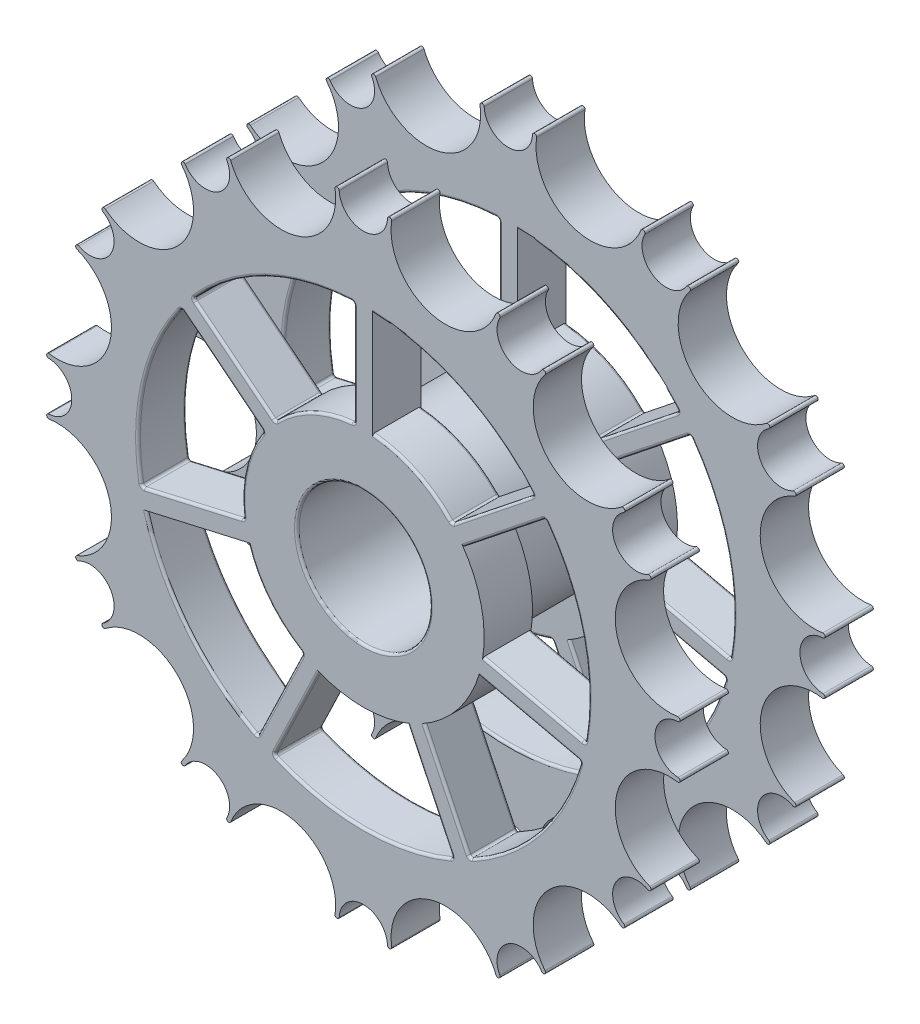
from build123d import *

# Parameters (mm, degrees)
BOSS_EXTRUDE1_DEPTH = 20
CUT_EXTRUDE1_REACH  = 330.167
SKETCH3_R           = 93.291525657
SKETCH4_R           = 50
BOSS_EXTRUDE2_DEPTH = 20
SKETCH7_W           = 7.655109398
SKETCH7_H           = 49.788152553
BOSS_EXTRUDE3_DEPTH = 20
CIRPATTERN1_COUNT   = 7
SKETCH8_R           = 27.538934532
CUT_EXTRUDE2_DEPTH  = 20
BOSS_EXTRUDE4_START = 39.999999756
SKETCH9_R           = 37.538934532
SKETCH9_R_2         = 27.538934532
BOSS_EXTRUDE4_DEPTH = 39.999999756
FILLET2_R           = 1


with BuildPart() as part:
    # Sketch2 → Boss-Extrude1 (new body)
    with BuildSketch(Plane.XY):
        with BuildLine():
            ThreePointArc((-179.091353862, 130.254695857), (-176.022517633, 123.453884992), (-169.1, 120.67044578))
            ThreePointArc((-169.1, 120.67044578), (-162.177482367, 123.453884992), (-159.108646138, 130.254695857))
            ThreePointArc((-159.108646138, 130.254695857), (-158.161758626, 131.08003725), (-157.388508681, 130.090153975))
            ThreePointArc((-157.388508681, 130.090153975), (-140.961721844, 105.013483715), (-114.197372011, 118.517123784))
            ThreePointArc((-114.197372011, 118.517123784), (-113.032776278, 118.987762875), (-112.625418334, 117.799552506))
            ThreePointArc((-112.625418334, 117.799552506), (-113.368133633, 110.375459415), (-108.76477711, 104.503671532))
            ThreePointArc((-108.76477711, 104.503671532), (-101.377981375, 103.452941782), (-95.319885808, 107.808198643))
            ThreePointArc((-95.319885808, 107.808198643), (-94.087186472, 108.0495215), (-93.912474015, 106.805632465))
            ThreePointArc((-93.912474015, 106.805632465), (-92.224794441, 76.875205559), (-62.294367535, 75.187525985))
            ThreePointArc((-62.294367535, 75.187525985), (-61.0504785, 75.012813528), (-61.291801357, 73.780114192))
            ThreePointArc((-61.291801357, 73.780114192), (-65.647058218, 67.722018625), (-64.596328468, 60.33522289))
            ThreePointArc((-64.596328468, 60.33522289), (-58.724540585, 55.731866367), (-51.300447494, 56.474581666))
            ThreePointArc((-51.300447494, 56.474581666), (-50.112237125, 56.067223722), (-50.582876216, 54.902627989))
            ThreePointArc((-50.582876216, 54.902627989), (-64.086516285, 28.138278156), (-39.009846025, 11.711491319))
            ThreePointArc((-39.009846025, 11.711491319), (-38.01996275, 10.938241374), (-38.845304143, 9.991353862))
            ThreePointArc((-38.845304143, 9.991353862), (-45.646115008, 6.922517633), (-48.42955422, 0))
            ThreePointArc((-48.42955422, 0), (-45.646115008, -6.922517633), (-38.845304143, -9.991353862))
            ThreePointArc((-38.845304143, -9.991353862), (-38.01996275, -10.938241374), (-39.009846025, -11.711491319))
            ThreePointArc((-39.009846025, -11.711491319), (-64.086516285, -28.138278156), (-50.582876216, -54.902627989))
            ThreePointArc((-50.582876216, -54.902627989), (-50.112237125, -56.067223722), (-51.300447494, -56.474581666))
            ThreePointArc((-51.300447494, -56.474581666), (-58.724540585, -55.731866367), (-64.596328468, -60.33522289))
            ThreePointArc((-64.596328468, -60.33522289), (-65.647058218, -67.722018625), (-61.291801357, -73.780114192))
            ThreePointArc((-61.291801357, -73.780114192), (-61.0504785, -75.012813528), (-62.294367535, -75.187525985))
            ThreePointArc((-62.294367535, -75.187525985), (-92.224794441, -76.875205559), (-93.912474015, -106.805632465))
            ThreePointArc((-93.912474015, -106.805632465), (-94.087186472, -108.0495215), (-95.319885808, -107.808198643))
            ThreePointArc((-95.319885808, -107.808198643), (-101.377981375, -103.452941782), (-108.76477711, -104.503671532))
            ThreePointArc((-108.76477711, -104.503671532), (-113.368133633, -110.375459415), (-112.625418334, -117.799552506))
            ThreePointArc((-112.625418334, -117.799552506), (-113.032776278, -118.987762875), (-114.197372011, -118.517123784))
            ThreePointArc((-114.197372011, -118.517123784), (-140.961721844, -105.013483715), (-157.388508681, -130.090153975))
            ThreePointArc((-157.388508681, -130.090153975), (-158.161758626, -131.08003725), (-159.108646138, -130.254695857))
            ThreePointArc((-159.108646138, -130.254695857), (-162.177482367, -123.453884992), (-169.1, -120.67044578))
            ThreePointArc((-169.1, -120.67044578), (-176.022517633, -123.453884992), (-179.091353862, -130.254695857))
            ThreePointArc((-179.091353862, -130.254695857), (-180.038241374, -131.08003725), (-180.811491319, -130.090153975))
            ThreePointArc((-180.811491319, -130.090153975), (-197.238278156, -105.013483715), (-224.002627989, -118.517123784))
            ThreePointArc((-224.002627989, -118.517123784), (-225.167223722, -118.987762875), (-225.574581666, -117.799552506))
            ThreePointArc((-225.574581666, -117.799552506), (-224.831866367, -110.375459415), (-229.43522289, -104.503671532))
            ThreePointArc((-229.43522289, -104.503671532), (-236.822018625, -103.452941782), (-242.880114192, -107.808198643))
            ThreePointArc((-242.880114192, -107.808198643), (-244.112813528, -108.0495215), (-244.287525985, -106.805632465))
            ThreePointArc((-244.287525985, -106.805632465), (-245.975205559, -76.875205559), (-275.905632465, -75.187525985))
            ThreePointArc((-275.905632465, -75.187525985), (-277.1495215, -75.012813528), (-276.908198643, -73.780114192))
            ThreePointArc((-276.908198643, -73.780114192), (-272.552941782, -67.722018625), (-273.603671532, -60.33522289))
            ThreePointArc((-273.603671532, -60.33522289), (-279.475459415, -55.731866367), (-286.899552506, -56.474581666))
            ThreePointArc((-286.899552506, -56.474581666), (-288.087762875, -56.067223722), (-287.617123784, -54.902627989))
            ThreePointArc((-287.617123784, -54.902627989), (-274.113483715, -28.138278156), (-299.190153975, -11.711491319))
            ThreePointArc((-299.190153975, -11.711491319), (-300.18003725, -10.938241374), (-299.354695857, -9.991353862))
            ThreePointArc((-299.354695857, -9.991353862), (-292.553884992, -6.922517633), (-289.77044578, 0))
            ThreePointArc((-289.77044578, 0), (-292.553884992, 6.922517633), (-299.354695857, 9.991353862))
            ThreePointArc((-299.354695857, 9.991353862), (-300.18003725, 10.938241374), (-299.190153975, 11.711491319))
            ThreePointArc((-299.190153975, 11.711491319), (-274.113483715, 28.138278156), (-287.617123784, 54.902627989))
            ThreePointArc((-287.617123784, 54.902627989), (-288.087762875, 56.067223722), (-286.899552506, 56.474581666))
            ThreePointArc((-286.899552506, 56.474581666), (-279.475459415, 55.731866367), (-273.603671532, 60.33522289))
            ThreePointArc((-273.603671532, 60.33522289), (-272.552941782, 67.722018625), (-276.908198643, 73.780114192))
            ThreePointArc((-276.908198643, 73.780114192), (-277.1495215, 75.012813528), (-275.905632465, 75.187525985))
            ThreePointArc((-275.905632465, 75.187525985), (-245.975205559, 76.875205559), (-244.287525985, 106.805632465))
            ThreePointArc((-244.287525985, 106.805632465), (-244.112813528, 108.0495215), (-242.880114192, 107.808198643))
            ThreePointArc((-242.880114192, 107.808198643), (-236.822018625, 103.452941782), (-229.43522289, 104.503671532))
            ThreePointArc((-229.43522289, 104.503671532), (-224.831866367, 110.375459415), (-225.574581666, 117.799552506))
            ThreePointArc((-225.574581666, 117.799552506), (-225.167223722, 118.987762875), (-224.002627989, 118.517123784))
            ThreePointArc((-224.002627989, 118.517123784), (-197.238278156, 105.013483715), (-180.811491319, 130.090153975))
            ThreePointArc((-180.811491319, 130.090153975), (-180.038241374, 131.08003725), (-179.091353862, 130.254695857))
        make_face()
    extrude(amount=-BOSS_EXTRUDE1_DEPTH)

    # Sketch3 → Cut-Extrude1 (cut, up to next)
    with BuildSketch(Plane(origin=(0, 0, -20), x_dir=(-1, 0, 0), z_dir=(0, 0, -1)), mode=Mode.PRIVATE) as cut_extrude1_sk1:
        with Locations((169.1, 0)):
            Circle(SKETCH3_R)
    cut_extrude1_tool1 = extrude(cut_extrude1_sk1.sketch, amount=-CUT_EXTRUDE1_REACH, mode=Mode.PRIVATE) & part.part
    add(cut_extrude1_tool1.solids().sort_by_distance((-169.1, 0, -20))[0], mode=Mode.SUBTRACT)



with BuildPart() as body_2:
    # Sketch4 → Boss-Extrude2 (new body)
    with BuildSketch(Plane.XY):
        with Locations((-169.1, 0)):
            Circle(SKETCH4_R)
    extrude(amount=-BOSS_EXTRUDE2_DEPTH)


with BuildPart() as part_1:
    add(part.part)

    add(body_2.part)  # Boss-Extrude3 merges body 2
    # Sketch7 → Boss-Extrude3 (add)
    with BuildSketch(Plane(origin=(0, 0, -20), x_dir=(-1, 0, 0), z_dir=(0, 0, -1))):
        with Locations((169.1, 72.020820056)):
            Rectangle(SKETCH7_W, SKETCH7_H)
    boss_extrude3 = extrude(amount=-BOSS_EXTRUDE3_DEPTH)

    # CirPattern1: Boss-Extrude3 ×7 about axis
    cirpattern1_axis = Axis((-169.1, 0, 0), (0, 0, 1))
    for i in range(1, CIRPATTERN1_COUNT):
        add(boss_extrude3.rotate(cirpattern1_axis, i * 360 / CIRPATTERN1_COUNT))

    # Sketch8 → Cut-Extrude2 (cut)
    with BuildSketch(Plane.XY):
        with Locations((-169.1, 0)):
            Circle(SKETCH8_R)
    extrude(amount=-CUT_EXTRUDE2_DEPTH, mode=Mode.SUBTRACT)


with BuildPart() as body_2_2:
    # Mirror11: mirrored copy
    add(part_1.part.mirror(Plane.XY.offset(19.999999878)))


with BuildPart() as part_2:
    add(part_1.part)

    add(body_2_2.part)  # Boss-Extrude4 merges body 2 2
    # Sketch9 → Boss-Extrude4 (add)
    with BuildSketch(Plane.XY.offset(BOSS_EXTRUDE4_START)):
        with Locations(Location((-169.1, 0, 0), (0, 0, 180))):
            Circle(SKETCH9_R)
        with Locations((-169.1, 0)):
            Circle(SKETCH9_R_2, mode=Mode.SUBTRACT)
    extrude(amount=-BOSS_EXTRUDE4_DEPTH)

    # Fillet2
    fillet2_edges = [part_2.edges().sort_by_distance(p)[0] for p in [
        (-128.62232402, 84.052760256, 0),
        (-128.62232402, 84.052760256, -20),
        (-172.927554699, 93.212974335, -10),
        (-172.927554699, 71.533128663, -20),
        (-172.927554699, 71.533128663, 0),
        (-172.927554699, 49.853282991, -10),
        (-190.794186956, 45.048443395, 0),
        (-147.405813044, 45.048443395, -20),
        (-217.846395609, 11.126046698, 0),
        (-190.794186956, 45.048443395, -20),
        (-205.690424827, 34.075516299, -10),
        (-210.463307468, 28.09051077, -10),
        (-209.57767598, 84.052760256, -20),
        (-209.57767598, 84.052760256, 0),
        (-222.640410708, 47.592678981, -20),
        (-227.413293349, 41.607673452, -20),
        (-227.413293349, 41.607673452, 0),
        (-222.640410708, 47.592678981, 0),
        (-244.36327923, 55.124836135, -10),
        (-239.590396589, 61.109841663, -10),
        (-260.052512333, 20.759317419, 0),
        (-208.191574123, -31.174490093, 0),
        (-260.052512333, 20.759317419, -20),
        (-217.846395609, 11.126046698, -20),
        (-239.691354826, -12.186028688, -20),
        (-237.987932733, -19.64920851, -20),
        (-216.851646056, -14.824989003, -10),
        (-237.987932733, -19.64920851, 0),
        (-239.691354826, -12.186028688, 0),
        (-218.555068149, -7.361809181, -10),
        (-259.12421941, -24.473428017, -10),
        (-260.827641503, -17.010248195, -10),
        (-242.038251806, -58.166314847, 0),
        (-169.1, -50, 0),
        (-242.038251806, -58.166314847, -20),
        (-208.191574123, -31.174490093, -20),
        (-203.585568959, -62.788408205, -20),
        (-203.585568959, -62.788408205, 0),
        (-194.179036455, -43.255542194, -10),
        (-212.992101462, -82.321274216, -10),
        (-169.1, -93.291525657, 0),
        (-169.1, -93.291525657, -20),
        (-169.1, -50, -20),
        (-141.511446288, -66.109835693, -20),
        (-134.614431041, -62.788408205, -20),
        (-134.614431041, -62.788408205, 0),
        (-141.511446288, -66.109835693, 0),
        (-150.917978792, -46.576969682, -10),
        (-125.207898538, -82.321274216, -10),
        (-132.104913785, -85.642701705, -10),
        (-96.161748194, -58.166314847, 0),
        (-96.161748194, -58.166314847, -20),
        (-100.212067267, -19.64920851, -20),
        (-98.508645174, -12.186028688, -20),
        (-98.508645174, -12.186028688, 0),
        (-100.212067267, -19.64920851, 0),
        (-77.372358497, -17.010248195, -10),
        (-79.07578059, -24.473428017, -10),
        (-78.147487667, 20.759317419, 0),
        (-147.405813044, 45.048443395, 0),
        (-78.147487667, 20.759317419, -20),
        (-110.786706651, 41.607673452, -20),
        (-115.559589292, 47.592678981, -20),
        (-132.509575173, 34.075516299, -10),
        (-115.559589292, 47.592678981, 0),
        (-110.786706651, 41.607673452, 0),
        (-98.609603411, 61.109841663, -10),
        (-93.83672077, 55.124836135, -10),
        (-196.638934532, 0, -20),
        (-128.62232402, 84.052760256, 39.999999756),
        (-132.509575173, 34.075516299, 49.999999756),
        (-147.405813044, 45.048443395, 39.999999756),
        (-147.405813044, 45.048443395, 59.999999756),
        (-78.147487667, 20.759317419, 39.999999756),
        (-96.161748194, -58.166314847, 39.999999756),
        (-169.1, -93.291525657, 39.999999756),
        (-242.038251806, -58.166314847, 39.999999756),
        (-194.179036455, -43.255542194, 49.999999756),
        (-208.191574123, -31.174490093, 59.999999756),
        (-208.191574123, -31.174490093, 39.999999756),
        (-260.052512333, 20.759317419, 39.999999756),
        (-218.555068149, -7.361809181, 49.999999756),
        (-217.846395609, 11.126046698, 59.999999756),
        (-210.463307468, 28.09051077, 49.999999756),
        (-217.846395609, 11.126046698, 39.999999756),
        (-196.638934532, 0, 59.999999756),
        (-78.147487667, 20.759317419, 59.999999756),
        (-128.62232402, 84.052760256, 59.999999756),
        (-96.161748194, -58.166314847, 59.999999756),
        (-169.1, -93.291525657, 59.999999756),
        (-242.038251806, -58.166314847, 59.999999756),
        (-260.052512333, 20.759317419, 59.999999756),
        (-209.57767598, 84.052760256, 59.999999756),
        (-110.786706651, 41.607673452, 39.999999756),
        (-98.508645174, -12.186028688, 39.999999756),
        (-115.559589292, 47.592678981, 39.999999756),
        (-100.212067267, -19.64920851, 39.999999756),
        (-134.614431041, -62.788408205, 39.999999756),
        (-141.511446288, -66.109835693, 39.999999756),
        (-196.688553712, -66.109835693, 39.999999756),
        (-203.585568959, -62.788408205, 39.999999756),
        (-239.691354826, -12.186028688, 39.999999756),
        (-227.413293349, 41.607673452, 39.999999756),
        (-172.927554699, 71.533128663, 39.999999756),
        (-222.640410708, 47.592678981, 39.999999756),
        (-209.57767598, 84.052760256, 39.999999756),
        (-172.927554699, 49.853282991, 49.999999756),
        (-172.927554699, 71.533128663, 59.999999756),
        (-172.927554699, 93.212974335, 49.999999756),
        (-205.690424827, 34.075516299, 49.999999756),
        (-190.794186956, 45.048443395, 59.999999756),
        (-190.794186956, 45.048443395, 39.999999756),
        (-244.36327923, 55.124836135, 49.999999756),
        (-227.413293349, 41.607673452, 59.999999756),
        (-239.590396589, 61.109841663, 49.999999756),
        (-222.640410708, 47.592678981, 59.999999756),
        (-260.827641503, -17.010248195, 49.999999756),
        (-239.691354826, -12.186028688, 59.999999756),
        (-206.095086215, -85.642701705, 49.999999756),
        (-196.688553712, -66.109835693, 59.999999756),
        (-212.992101462, -82.321274216, 49.999999756),
        (-203.585568959, -62.788408205, 59.999999756),
        (-125.207898538, -82.321274216, 49.999999756),
        (-134.614431041, -62.788408205, 59.999999756),
        (-132.104913785, -85.642701705, 49.999999756),
        (-141.511446288, -66.109835693, 59.999999756),
        (-77.372358497, -17.010248195, 49.999999756),
        (-98.508645174, -12.186028688, 59.999999756),
        (-79.07578059, -24.473428017, 49.999999756),
        (-100.212067267, -19.64920851, 59.999999756),
        (-98.609603411, 61.109841663, 49.999999756),
        (-115.559589292, 47.592678981, 59.999999756),
        (-93.83672077, 55.124836135, 49.999999756),
        (-110.786706651, 41.607673452, 59.999999756),
    ]]
    fillet(fillet2_edges, radius=FILLET2_R)


solid = part_2.part
